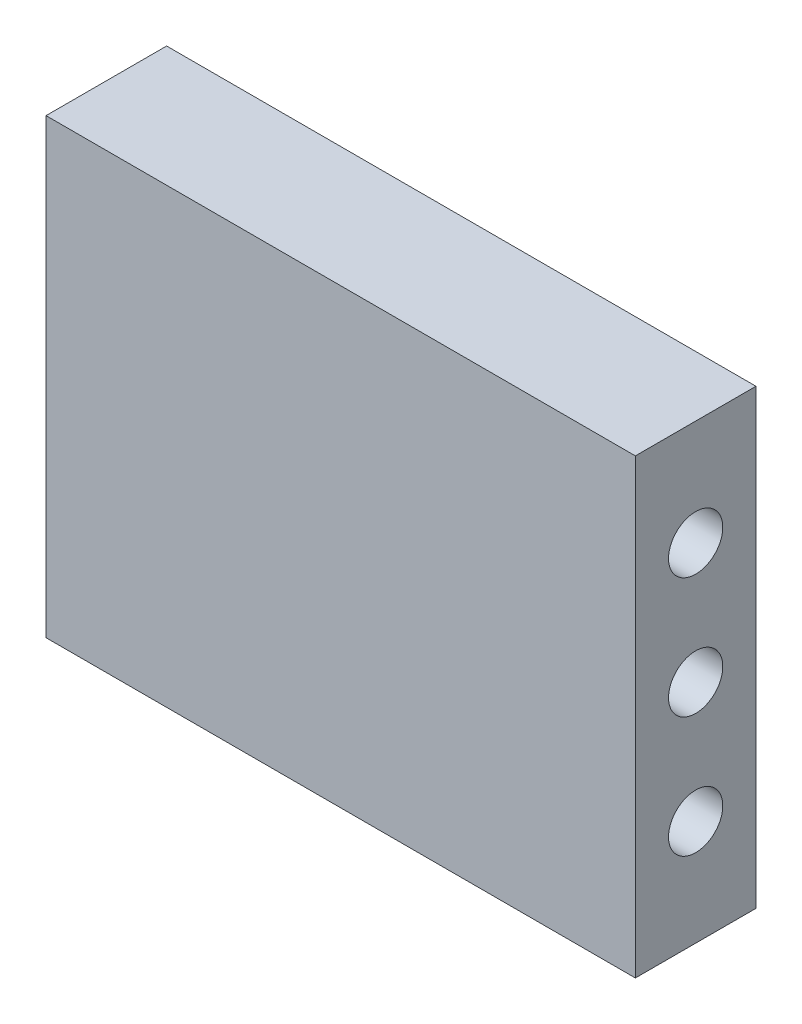
from build123d import *

# Parameters (mm, degrees)
SKETCH_1_W          = 39.1
SKETCH_1_H          = 30
EXTRUDE_1_DEPTH     = 8
SKETCH_2_R          = 1.8
CUT_EXTRUDE_1_DEPTH = 44.826627362


with BuildPart() as part:
    # 草圖1 → 填料-伸長1 (new body)
    with BuildSketch(Plane.XY):
        with Locations((15.847455636, -3.109756098)):
            Rectangle(SKETCH_1_W, SKETCH_1_H)
    extrude(amount=EXTRUDE_1_DEPTH)

    # 草圖2 → 除料-伸長1 (cut, through all)
    with BuildSketch(Plane.ZY.offset(3.702544364)):
        with Locations((4, 4.890243902)):
            Circle(SKETCH_2_R)
        with Locations((4, -3.109756098)):
            Circle(SKETCH_2_R)
        with Locations((4, -11.109756098)):
            Circle(SKETCH_2_R)
    extrude(amount=-CUT_EXTRUDE_1_DEPTH, mode=Mode.SUBTRACT)


solid = part.part
